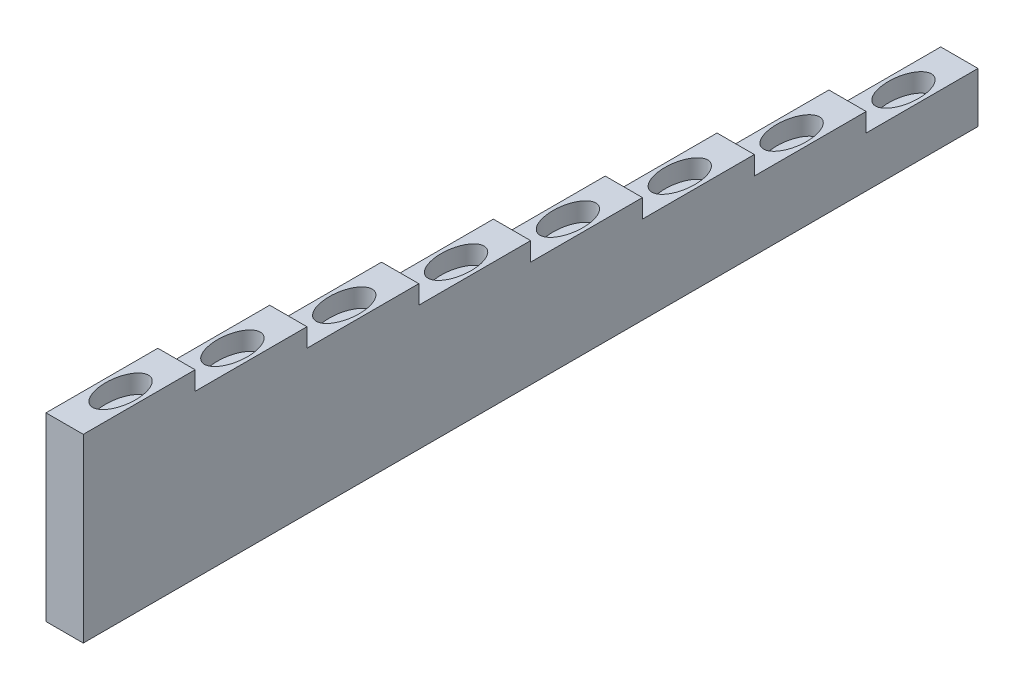
from build123d import *

# Parameters (mm, degrees)
BOSS_EXTRUDE1_DEPTH      = 48
CUT_EXTRUDE4_DEPTH       = 2
CUT_EXTRUDE6_DEPTH       = 9
CUT_EXTRUDE6_DEPTH_BACK  = 1
SKETCH8_RX               = 1.5
SKETCH8_RY               = 0.8
CUT_EXTRUDE7_DEPTH       = 11
CUT_EXTRUDE7_DEPTH_BACK  = 1
SKETCH13_RX              = 1.5
SKETCH13_RY              = 0.8
CUT_EXTRUDE8_DEPTH       = 13
CUT_EXTRUDE8_DEPTH_BACK  = 1
SKETCH14_RX              = 1.5
SKETCH14_RY              = 0.8
CUT_EXTRUDE9_DEPTH       = 15
CUT_EXTRUDE9_DEPTH_BACK  = 1
SKETCH15_RX              = 1.5
SKETCH15_RY              = 0.8
CUT_EXTRUDE10_DEPTH      = 17
CUT_EXTRUDE10_DEPTH_BACK = 1
SKETCH16_RX              = 1.5
SKETCH16_RY              = 0.8
CUT_EXTRUDE11_DEPTH      = 19
CUT_EXTRUDE11_DEPTH_BACK = 1
SKETCH17_RX              = 1.5
SKETCH17_RY              = 0.8
CUT_EXTRUDE12_DEPTH      = 21
CUT_EXTRUDE12_DEPTH_BACK = 1
SKETCH18_RX              = 1.5
SKETCH18_RY              = 0.8
CUT_EXTRUDE13_DEPTH      = 23
CUT_EXTRUDE13_DEPTH_BACK = 1
SKETCH19_RX              = 1.5
SKETCH19_RY              = 0.8
SKETCH20_W               = 61.407499633
SKETCH20_H               = 22.367478321
CUT_EXTRUDE14_DEPTH      = 10


with BuildPart() as part:
    # Sketch2 → Boss-Extrude1 (new body)
    with BuildSketch(Plane.XY):
        Polygon((-7.23, -20.3), (-7.23, -34), (-9.23, -34), (-9.23, -2), (-7.23, -2), align=None)
    extrude(amount=BOSS_EXTRUDE1_DEPTH)

    # Sketch7 → Cut-Extrude4 (cut)
    with BuildSketch(Plane(origin=(-7.23, 0, 0), x_dir=(0, 0, -1), z_dir=(1, 0, 0))):
        Polygon((-48, -16.3), (-48, -24.3), (-42, -24.3), (-42, -25.3), (-36, -25.3), (-36, -26.3), (-30, -26.3), (-30, -27.3), (-24, -27.3), (-24, -28.3), (-18, -28.3), (-18, -29.3), (-12, -29.3), (-12, -30.3), (-6, -30.3), (-6, -31.3), (0, -31.3), (0, -9.3), (-6, -9.3), (-6, -10.3), (-12, -10.3), (-12, -11.3), (-18, -11.3), (-18, -12.3), (-24, -12.3), (-24, -13.3), (-30, -13.3), (-30, -14.3), (-36, -14.3), (-36, -15.3), (-42, -15.3), (-42, -16.3), align=None)
    extrude(amount=-CUT_EXTRUDE4_DEPTH, mode=Mode.SUBTRACT)


with BuildPart() as cut_extrude4_piece_1:
    # of the separate pieces the step leaves, piece 1, a body of its own (cut_extrude4_pieces)
    add(part.part.solids().sort_by_distance((-7.23, -9.3, 0))[0])


with BuildPart() as cut_extrude4_piece_2:
    # of the separate pieces the step leaves, piece 2, a body of its own (cut_extrude4_pieces)
    add(part.part.solids().sort_by_distance((-7.23, -34, 0))[0])


with BuildPart() as cut_extrude6_tool:
    # Sketch8 → Cut-Extrude6 (new, two sides: drawn at the far end of the back side and taken through both)
    with BuildSketch(Plane(origin=(0, -24.3, 0), x_dir=(1, 0, 0), z_dir=(0, 1, 0)).offset(-CUT_EXTRUDE6_DEPTH_BACK)):
        with Locations(Location((-8.23, -45), (0, 0, 90))):
            Ellipse(SKETCH8_RX, SKETCH8_RY)
    extrude(amount=CUT_EXTRUDE6_DEPTH + CUT_EXTRUDE6_DEPTH_BACK)


with BuildPart() as cut_extrude4_piece_1_1:
    add(cut_extrude4_piece_1.part)

    # Cut-Extrude6: cut by cut_extrude6_tool
    add(cut_extrude6_tool.part, mode=Mode.SUBTRACT)


with BuildPart() as cut_extrude4_piece_2_1:
    add(cut_extrude4_piece_2.part)

    # Cut-Extrude6: cut by cut_extrude6_tool
    add(cut_extrude6_tool.part, mode=Mode.SUBTRACT)


with BuildPart() as cut_extrude7_tool:
    # Sketch13 → Cut-Extrude7 (new, two sides: drawn at the far end of the back side and taken through both)
    with BuildSketch(Plane(origin=(0, -25.3, 0), x_dir=(1, 0, 0), z_dir=(0, 1, 0)).offset(-CUT_EXTRUDE7_DEPTH_BACK)):
        with Locations(Location((-8.23, -39), (0, 0, 90))):
            Ellipse(SKETCH13_RX, SKETCH13_RY)
    extrude(amount=CUT_EXTRUDE7_DEPTH + CUT_EXTRUDE7_DEPTH_BACK)


with BuildPart() as cut_extrude4_piece_1_2:
    add(cut_extrude4_piece_1_1.part)

    # Cut-Extrude7: cut by cut_extrude7_tool
    add(cut_extrude7_tool.part, mode=Mode.SUBTRACT)


with BuildPart() as cut_extrude4_piece_2_2:
    add(cut_extrude4_piece_2_1.part)

    # Cut-Extrude7: cut by cut_extrude7_tool
    add(cut_extrude7_tool.part, mode=Mode.SUBTRACT)


with BuildPart() as cut_extrude8_tool:
    # Sketch14 → Cut-Extrude8 (new, two sides: drawn at the far end of the back side and taken through both)
    with BuildSketch(Plane(origin=(0, -26.3, 0), x_dir=(1, 0, 0), z_dir=(0, 1, 0)).offset(-CUT_EXTRUDE8_DEPTH_BACK)):
        with Locations(Location((-8.23, -33), (0, 0, 90))):
            Ellipse(SKETCH14_RX, SKETCH14_RY)
    extrude(amount=CUT_EXTRUDE8_DEPTH + CUT_EXTRUDE8_DEPTH_BACK)


with BuildPart() as cut_extrude4_piece_1_3:
    add(cut_extrude4_piece_1_2.part)

    # Cut-Extrude8: cut by cut_extrude8_tool
    add(cut_extrude8_tool.part, mode=Mode.SUBTRACT)


with BuildPart() as cut_extrude4_piece_2_3:
    add(cut_extrude4_piece_2_2.part)

    # Cut-Extrude8: cut by cut_extrude8_tool
    add(cut_extrude8_tool.part, mode=Mode.SUBTRACT)


with BuildPart() as cut_extrude9_tool:
    # Sketch15 → Cut-Extrude9 (new, two sides: drawn at the far end of the back side and taken through both)
    with BuildSketch(Plane(origin=(0, -27.3, 0), x_dir=(1, 0, 0), z_dir=(0, 1, 0)).offset(-CUT_EXTRUDE9_DEPTH_BACK)):
        with Locations(Location((-8.23, -27), (0, 0, 90))):
            Ellipse(SKETCH15_RX, SKETCH15_RY)
    extrude(amount=CUT_EXTRUDE9_DEPTH + CUT_EXTRUDE9_DEPTH_BACK)


with BuildPart() as cut_extrude4_piece_1_4:
    add(cut_extrude4_piece_1_3.part)

    # Cut-Extrude9: cut by cut_extrude9_tool
    add(cut_extrude9_tool.part, mode=Mode.SUBTRACT)


with BuildPart() as cut_extrude4_piece_2_4:
    add(cut_extrude4_piece_2_3.part)

    # Cut-Extrude9: cut by cut_extrude9_tool
    add(cut_extrude9_tool.part, mode=Mode.SUBTRACT)


with BuildPart() as cut_extrude10_tool:
    # Sketch16 → Cut-Extrude10 (new, two sides: drawn at the far end of the back side and taken through both)
    with BuildSketch(Plane(origin=(0, -28.3, 0), x_dir=(1, 0, 0), z_dir=(0, 1, 0)).offset(-CUT_EXTRUDE10_DEPTH_BACK)):
        with Locations(Location((-8.23, -21), (0, 0, 90))):
            Ellipse(SKETCH16_RX, SKETCH16_RY)
    extrude(amount=CUT_EXTRUDE10_DEPTH + CUT_EXTRUDE10_DEPTH_BACK)


with BuildPart() as cut_extrude4_piece_1_5:
    add(cut_extrude4_piece_1_4.part)

    # Cut-Extrude10: cut by cut_extrude10_tool
    add(cut_extrude10_tool.part, mode=Mode.SUBTRACT)


with BuildPart() as cut_extrude4_piece_2_5:
    add(cut_extrude4_piece_2_4.part)

    # Cut-Extrude10: cut by cut_extrude10_tool
    add(cut_extrude10_tool.part, mode=Mode.SUBTRACT)


with BuildPart() as cut_extrude11_tool:
    # Sketch17 → Cut-Extrude11 (new, two sides: drawn at the far end of the back side and taken through both)
    with BuildSketch(Plane(origin=(0, -29.3, 0), x_dir=(1, 0, 0), z_dir=(0, 1, 0)).offset(-CUT_EXTRUDE11_DEPTH_BACK)):
        with Locations(Location((-8.23, -15), (0, 0, 90))):
            Ellipse(SKETCH17_RX, SKETCH17_RY)
    extrude(amount=CUT_EXTRUDE11_DEPTH + CUT_EXTRUDE11_DEPTH_BACK)


with BuildPart() as cut_extrude4_piece_1_6:
    add(cut_extrude4_piece_1_5.part)

    # Cut-Extrude11: cut by cut_extrude11_tool
    add(cut_extrude11_tool.part, mode=Mode.SUBTRACT)


with BuildPart() as cut_extrude4_piece_2_6:
    add(cut_extrude4_piece_2_5.part)

    # Cut-Extrude11: cut by cut_extrude11_tool
    add(cut_extrude11_tool.part, mode=Mode.SUBTRACT)


with BuildPart() as cut_extrude12_tool:
    # Sketch18 → Cut-Extrude12 (new, two sides: drawn at the far end of the back side and taken through both)
    with BuildSketch(Plane(origin=(0, -30.3, 0), x_dir=(1, 0, 0), z_dir=(0, 1, 0)).offset(-CUT_EXTRUDE12_DEPTH_BACK)):
        with Locations(Location((-8.23, -9), (0, 0, 90))):
            Ellipse(SKETCH18_RX, SKETCH18_RY)
    extrude(amount=CUT_EXTRUDE12_DEPTH + CUT_EXTRUDE12_DEPTH_BACK)


with BuildPart() as cut_extrude4_piece_1_7:
    add(cut_extrude4_piece_1_6.part)

    # Cut-Extrude12: cut by cut_extrude12_tool
    add(cut_extrude12_tool.part, mode=Mode.SUBTRACT)


with BuildPart() as cut_extrude4_piece_2_7:
    add(cut_extrude4_piece_2_6.part)

    # Cut-Extrude12: cut by cut_extrude12_tool
    add(cut_extrude12_tool.part, mode=Mode.SUBTRACT)


with BuildPart() as cut_extrude13_tool:
    # Sketch19 → Cut-Extrude13 (new, two sides: drawn at the far end of the back side and taken through both)
    with BuildSketch(Plane(origin=(0, -31.3, 0), x_dir=(1, 0, 0), z_dir=(0, 1, 0)).offset(-CUT_EXTRUDE13_DEPTH_BACK)):
        with Locations(Location((-8.23, -3), (0, 0, 90))):
            Ellipse(SKETCH19_RX, SKETCH19_RY)
    extrude(amount=CUT_EXTRUDE13_DEPTH + CUT_EXTRUDE13_DEPTH_BACK)


with BuildPart() as cut_extrude4_piece_1_8:
    add(cut_extrude4_piece_1_7.part)

    # Cut-Extrude13: cut by cut_extrude13_tool
    add(cut_extrude13_tool.part, mode=Mode.SUBTRACT)

    # Sketch20 → Cut-Extrude14 (cut)
    with BuildSketch(Plane(origin=(0, 0, 0), x_dir=(0, 0, -1), z_dir=(1, 0, 0))):
        with Locations((-22.424003226, -10.633869098)):
            Rectangle(SKETCH20_W, SKETCH20_H)
    extrude(amount=-CUT_EXTRUDE14_DEPTH, mode=Mode.SUBTRACT)


with BuildPart() as cut_extrude4_piece_2_8:
    add(cut_extrude4_piece_2_7.part)

    # Cut-Extrude13: cut by cut_extrude13_tool
    add(cut_extrude13_tool.part, mode=Mode.SUBTRACT)


solid = cut_extrude4_piece_2_8.part
